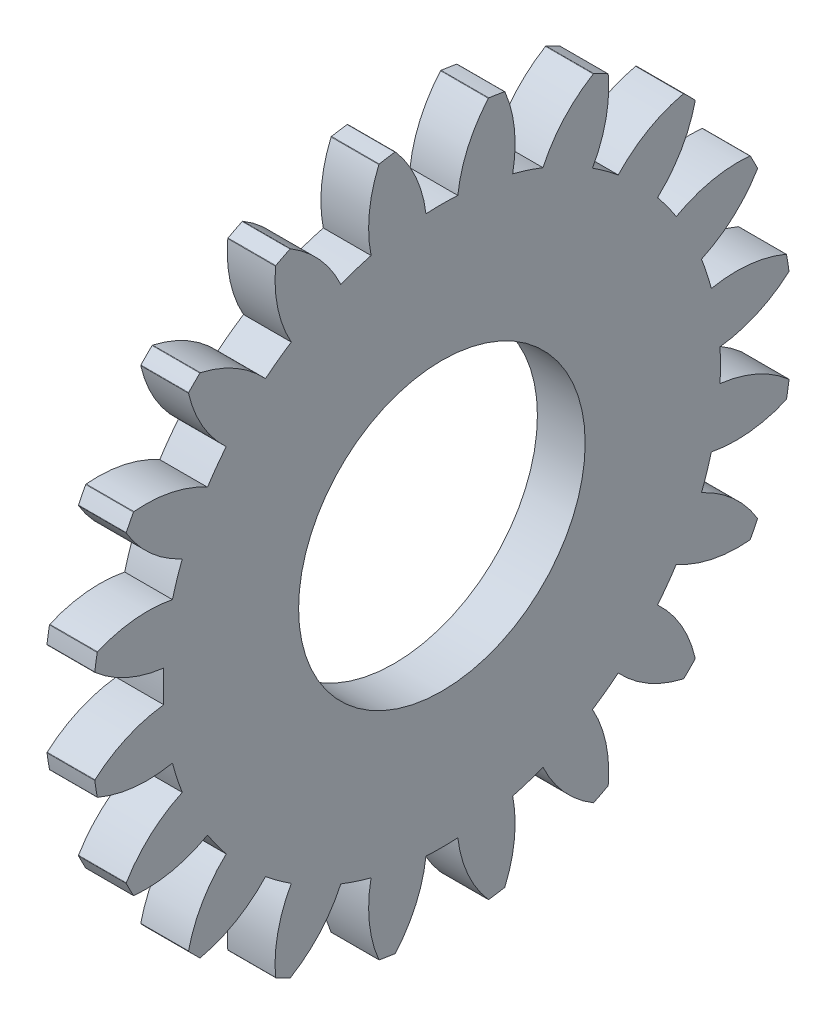
from build123d import *

# Parameters (mm, degrees)
BASPROSKE_W           = 1.5
BASPROSKE_H           = 11
TOOTHCUT_DEPTH        = 16.628499608
BREAKS_R              = 0.02
TEETHCUTS_COUNT       = 20
TEETHCUTS_ANGLE       = 342
BREAKS_OF_TEETHCUTS_R = 0.02
BORSKE_R              = 4.5
BORE_DEPTH            = 50.0000508


with BuildPart() as part:
    # BasProSke → Base-Revolve (revolve)
    with BuildSketch(Plane(origin=(0, 0, 0), x_dir=(1, 0, 0), z_dir=(0, 1, 0)), mode=Mode.PRIVATE) as base_revolve_sk:
        with Locations((0.75, 5.5)):
            Rectangle(BASPROSKE_W, BASPROSKE_H)
    revolve(base_revolve_sk.sketch.rotate(Axis((-10, 0, 0), (1, 0, 0)), 180), axis=Axis((-10, 0, 0), (1, 0, 0)))

    # TooCutSke → ToothCut (cut, through all)
    with BuildSketch(Plane(origin=(0, 0, 0), x_dir=(0, 0, -1), z_dir=(1, 0, 0))):
        with BuildLine():
            ThreePointArc((0.499924007, 8.734705318), (0, 8.749), (-0.499924007, 8.734705318))
            ThreePointArc((-0.499924007, 8.734705318), (-0.824302243, 9.905497836), (-1.485192705, 10.924909509))
            ThreePointArc((-1.485192705, 10.924909509), (0, 11.0254), (1.485192705, 10.924909509))
            ThreePointArc((1.485192705, 10.924909509), (0.824302243, 9.905497836), (0.499924007, 8.734705318))
        make_face()
    toothcut = extrude(amount=TOOTHCUT_DEPTH, mode=Mode.SUBTRACT)

    # Breaks
    breaks_edges = [part.edges().sort_by_distance(p)[0] for p in [
        (0.75, 10.902013697, -1.464956435),
        (0.75, 10.902013697, 1.464956435),
    ]]
    fillet(breaks_edges, radius=BREAKS_R)

    # TeethCuts: ToothCut ×20 about axis
    teethcuts_axis = Axis((-10, 0, 0), (1, 0, 0))
    for i in range(1, TEETHCUTS_COUNT):
        add(toothcut.rotate(teethcuts_axis, i * TEETHCUTS_ANGLE / (TEETHCUTS_COUNT - 1)), mode=Mode.SUBTRACT)

    # Breaks of TeethCuts
    breaks_of_teethcuts_edges = [part.edges().sort_by_distance(p)[0] for p in [
        (0.75, 10.821127601, 1.975651141),
        (0.75, 9.915734733, 4.762163869),
        (0.75, 9.680994141, 5.222868219),
        (0.75, 7.958834566, 7.593217523),
        (0.75, 7.593217523, 7.958834566),
        (0.75, 5.222868219, 9.680994141),
        (0.75, 4.762163869, 9.915734733),
        (0.75, 1.975651141, 10.821127601),
        (0.75, 1.464956435, 10.902013697),
        (0.75, -1.464956435, 10.902013697),
        (0.75, -1.975651141, 10.821127601),
        (0.75, -4.762163869, 9.915734733),
        (0.75, -5.222868219, 9.680994141),
        (0.75, -7.593217523, 7.958834566),
        (0.75, -7.958834566, 7.593217523),
        (0.75, -9.680994141, 5.222868219),
        (0.75, -9.915734733, 4.762163869),
        (0.75, -10.821127601, 1.975651141),
        (0.75, -10.902013697, 1.464956435),
        (0.75, -10.902013697, -1.464956435),
        (0.75, -10.821127601, -1.975651141),
        (0.75, -9.915734733, -4.762163869),
        (0.75, -9.680994141, -5.222868219),
        (0.75, -7.958834566, -7.593217523),
        (0.75, -7.593217523, -7.958834566),
        (0.75, -5.222868219, -9.680994141),
        (0.75, -4.762163869, -9.915734733),
        (0.75, -1.975651141, -10.821127601),
        (0.75, -1.464956435, -10.902013697),
        (0.75, 1.464956435, -10.902013697),
        (0.75, 1.975651141, -10.821127601),
        (0.75, 4.762163869, -9.915734733),
        (0.75, 5.222868219, -9.680994141),
        (0.75, 7.593217523, -7.958834566),
        (0.75, 7.958834566, -7.593217523),
        (0.75, 9.680994141, -5.222868219),
        (0.75, 9.915734733, -4.762163869),
        (0.75, 10.821127601, -1.975651141),
    ]]
    fillet(breaks_of_teethcuts_edges, radius=BREAKS_OF_TEETHCUTS_R)

    # BorSke → Bore (cut, symmetric)
    with BuildSketch(Plane(origin=(0, 0, 0), x_dir=(0, 0, -1), z_dir=(1, 0, 0))):
        with Locations(Location((0, 0, 0), (0, 0, 180))):
            Circle(BORSKE_R)
    extrude(amount=BORE_DEPTH, both=True, mode=Mode.SUBTRACT)


solid = part.part
